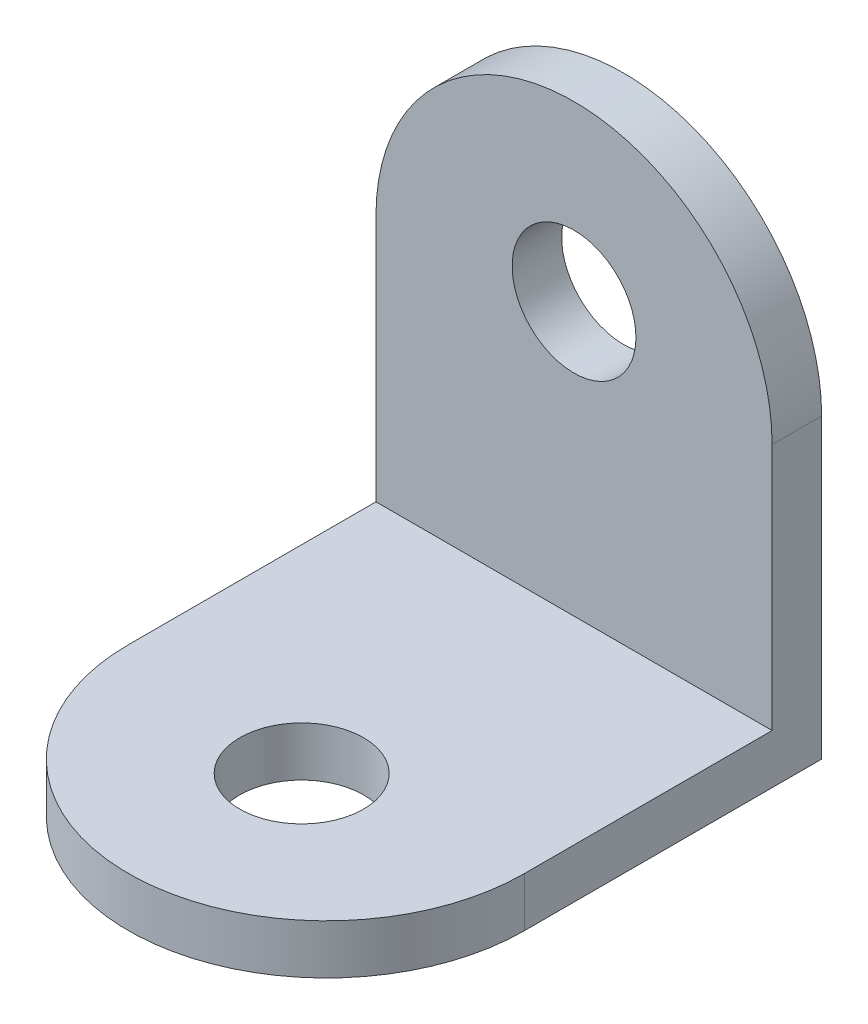
from build123d import *

# Parameters (mm, degrees)
SKETCH_1_R      = 2.5
EXTRUDE_1_DEPTH = 2
SKETCH_3_R      = 2.5
EXTRUDE_2_DEPTH = 2


with BuildPart() as part:
    # 草图1 → 凸台-拉伸1 (new body)
    with BuildSketch(Plane.XY):
        with BuildLine():
            Line((-8, 0), (-8, -12))
            Line((-8, -12), (8, -12))
            Line((8, -12), (8, 0))
            ThreePointArc((8, 0), (0, 8), (-8, 0))
        make_face()
        with Locations((0, 1)):
            Circle(SKETCH_1_R, mode=Mode.SUBTRACT)
    extrude(amount=EXTRUDE_1_DEPTH)

    # 草图3 → 凸台-拉伸2 (add)
    with BuildSketch(Plane.XZ.offset(12)):
        with BuildLine():
            Line((-8, 12), (-8, 0))
            Line((-8, 0), (8, 0))
            Line((8, 0), (8, 12))
            ThreePointArc((8, 12), (0, 20), (-8, 12))
        make_face()
        with Locations(Location((0, 13, 0), (0, 0, 270))):
            Circle(SKETCH_3_R, mode=Mode.SUBTRACT)
    extrude(amount=-EXTRUDE_2_DEPTH)


solid = part.part
